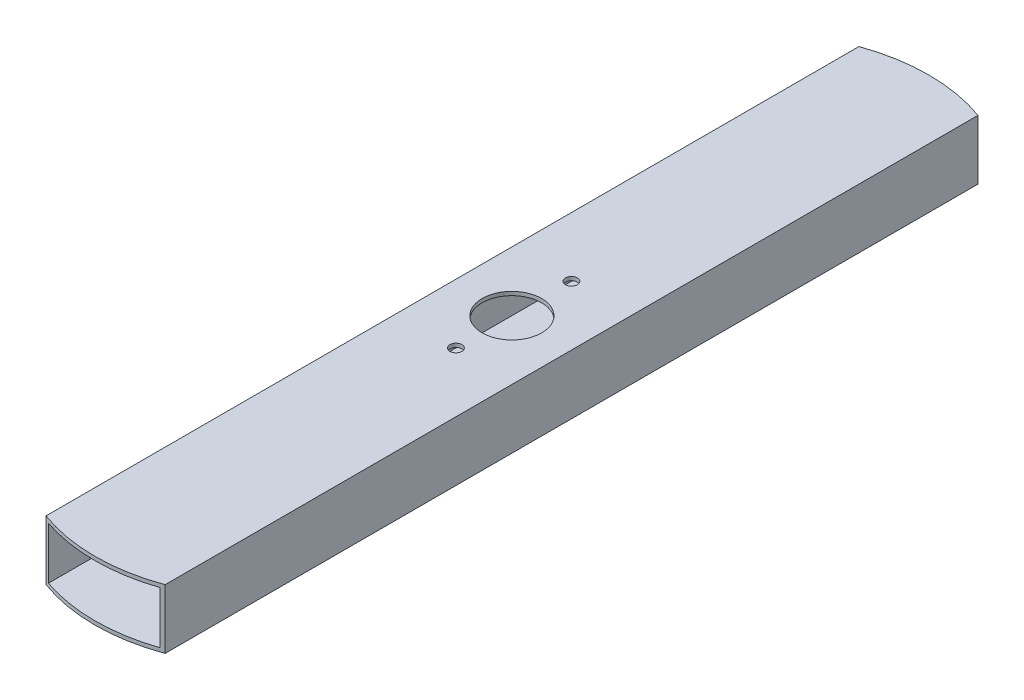
from build123d import *

# Parameters (mm, degrees)
SKETCH1_W           = 50.8
SKETCH1_H           = 25.4
SKETCH1_W_2         = 47.625
SKETCH1_H_2         = 22.225
BOSS_EXTRUDE1_DEPTH = 355.6
SKETCH2_R           = 12.7
SKETCH2_R_2         = 2.54
CUT_EXTRUDE4_DEPTH  = 32.766
CUT_EXTRUDE5_REACH  = 359.41


with BuildPart() as part:
    # Sketch1 → Boss-Extrude1 (new body)
    with BuildSketch(Plane.XY):
        Rectangle(SKETCH1_W, SKETCH1_H)
        Rectangle(SKETCH1_W_2, SKETCH1_H_2, mode=Mode.SUBTRACT)
    extrude(amount=BOSS_EXTRUDE1_DEPTH)

    # Sketch2 → Cut-Extrude4 (cut)
    with BuildSketch(Plane(origin=(0, 12.7, 0), x_dir=(1, 0, 0), z_dir=(0, 1, 0))):
        with Locations(Location((0, -177.8, 0), (0, 0, 180))):
            Circle(SKETCH2_R)
        with Locations(Location((0, -152.4, 0), (0, 0, 180))):
            Circle(SKETCH2_R_2)
        with Locations(Location((0, -201.676, 0), (0, 0, 180))):
            Circle(SKETCH2_R_2)
    extrude(amount=-CUT_EXTRUDE4_DEPTH, mode=Mode.SUBTRACT)

    # Sketch3 → Cut-Extrude5 (cut, up to next)
    with BuildSketch(Plane.XZ.offset(12.7), mode=Mode.PRIVATE) as cut_extrude5_sk1:
        with BuildLine():
            ThreePointArc((-4.48e-07, 355.6), (12.899331681, 354.46174048), (25.4, 351.082140551))
            Line((25.4, 351.082140551), (25.4, 355.6))
            Line((25.4, 355.6), (-4.48e-07, 355.6))
        make_face()
    cut_extrude5_tool1 = extrude(cut_extrude5_sk1.sketch, amount=-CUT_EXTRUDE5_REACH, mode=Mode.PRIVATE) & part.part
    # Sketch3 → Cut-Extrude5 (cut, up to next)
    with BuildSketch(Plane.XZ.offset(12.7), mode=Mode.PRIVATE) as cut_extrude5_sk2:
        with BuildLine():
            Line((-25.4, 355.6), (-25.4, 351.082140551))
            ThreePointArc((-25.4, 351.082140551), (-12.899332122, 354.461740401), (-4.48e-07, 355.6))
            Line((-4.48e-07, 355.6), (-25.4, 355.6))
        make_face()
    cut_extrude5_tool2 = extrude(cut_extrude5_sk2.sketch, amount=-CUT_EXTRUDE5_REACH, mode=Mode.PRIVATE) & part.part
    # Sketch3 → Cut-Extrude5 (cut, up to next)
    with BuildSketch(Plane.XZ.offset(12.7), mode=Mode.PRIVATE) as cut_extrude5_sk3:
        with BuildLine():
            ThreePointArc((25.4, 4.436419441), (12.892263223, 1.117437052), (-2.64e-07, 0))
            Line((-2.64e-07, 0), (25.4, 0))
            Line((25.4, 0), (25.4, 4.436419441))
        make_face()
    cut_extrude5_tool3 = extrude(cut_extrude5_sk3.sketch, amount=-CUT_EXTRUDE5_REACH, mode=Mode.PRIVATE) & part.part
    # Sketch3 → Cut-Extrude5 (cut, up to next)
    with BuildSketch(Plane.XZ.offset(12.7), mode=Mode.PRIVATE) as cut_extrude5_sk4:
        with BuildLine():
            Line((-25.4, 4.436419441), (-25.4, 0))
            Line((-25.4, 0), (-2.64e-07, 0))
            ThreePointArc((-2.64e-07, 0), (-12.892263483, 1.117437097), (-25.4, 4.436419441))
        make_face()
    cut_extrude5_tool4 = extrude(cut_extrude5_sk4.sketch, amount=-CUT_EXTRUDE5_REACH, mode=Mode.PRIVATE) & part.part
    add(cut_extrude5_tool1.solids().sort_by_distance((19.0896, -12.7, 354.252078))[0], mode=Mode.SUBTRACT)
    add(cut_extrude5_tool2.solids().sort_by_distance((-19.0896, -12.7, 354.252078))[0], mode=Mode.SUBTRACT)
    add(cut_extrude5_tool3.solids().sort_by_distance((19.088205, -12.7, 1.323888))[0], mode=Mode.SUBTRACT)
    add(cut_extrude5_tool4.solids().sort_by_distance((-19.088205, -12.7, 1.323888))[0], mode=Mode.SUBTRACT)


solid = part.part
